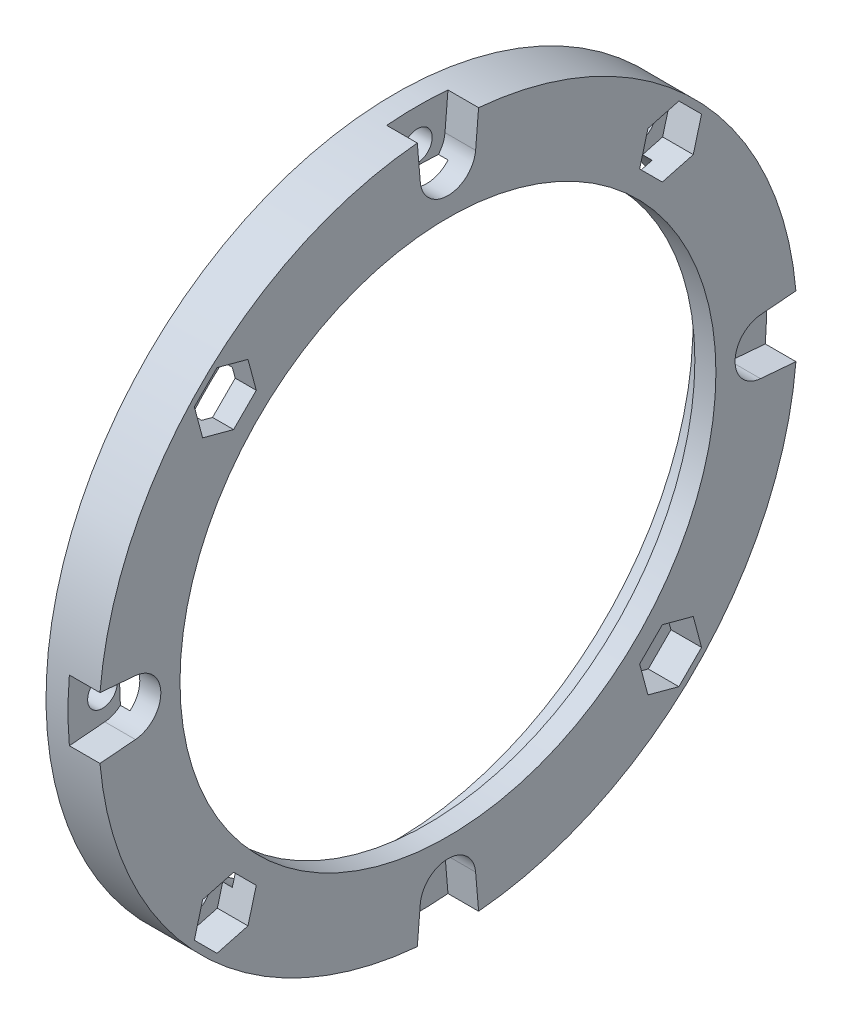
from build123d import *

# Parameters (mm, degrees)
SKETCH_1_R          = 36.5
SKETCH_1_R_2        = 28
EXTRUDE_1_DEPTH     = 5.5
SKETCH_2_R          = 31.1
CUT_EXTRUDE_1_DEPTH = 3.3
CUT_EXTRUDE_2_REACH = 53.911
SKETCH_3_R          = 1.55
SKETCH_4_R          = 1.55
CUT_EXTRUDE_3_DEPTH = 3.2


with BuildPart() as part:
    # 草图1 → 凸台-拉伸1 (new body)
    with BuildSketch(Plane(origin=(0, 0, 0), x_dir=(0, 0, -1), z_dir=(1, 0, 0))):
        Circle(SKETCH_1_R)
        Circle(SKETCH_1_R_2, mode=Mode.SUBTRACT)
    extrude(amount=EXTRUDE_1_DEPTH)

    # 草图2 → 切除-拉伸1 (cut)
    with BuildSketch(Plane.ZY):
        Circle(SKETCH_2_R)
    extrude(amount=-CUT_EXTRUDE_1_DEPTH, mode=Mode.SUBTRACT)

    # 草图3 → 切除-拉伸2 (cut, up to next)
    with BuildSketch(Plane(origin=(5.5, 0, 0), x_dir=(0, 0, -1), z_dir=(1, 0, 0)), mode=Mode.PRIVATE) as cut_extrude_2_sk1:
        with Locations((32.9, 0)):
            Circle(SKETCH_3_R)
    cut_extrude_2_tool1 = extrude(cut_extrude_2_sk1.sketch, amount=-CUT_EXTRUDE_2_REACH, mode=Mode.PRIVATE) & part.part
    # 草图3 → 切除-拉伸2 (cut, up to next)
    with BuildSketch(Plane(origin=(5.5, 0, 0), x_dir=(0, 0, -1), z_dir=(1, 0, 0)), mode=Mode.PRIVATE) as cut_extrude_2_sk2:
        with Locations((23.263813101, -23.263813101)):
            Circle(SKETCH_3_R)
    cut_extrude_2_tool2 = extrude(cut_extrude_2_sk2.sketch, amount=-CUT_EXTRUDE_2_REACH, mode=Mode.PRIVATE) & part.part
    # 草图3 → 切除-拉伸2 (cut, up to next)
    with BuildSketch(Plane(origin=(5.5, 0, 0), x_dir=(0, 0, -1), z_dir=(1, 0, 0)), mode=Mode.PRIVATE) as cut_extrude_2_sk3:
        with Locations((0, -32.9)):
            Circle(SKETCH_3_R)
    cut_extrude_2_tool3 = extrude(cut_extrude_2_sk3.sketch, amount=-CUT_EXTRUDE_2_REACH, mode=Mode.PRIVATE) & part.part
    # 草图3 → 切除-拉伸2 (cut, up to next)
    with BuildSketch(Plane(origin=(5.5, 0, 0), x_dir=(0, 0, -1), z_dir=(1, 0, 0)), mode=Mode.PRIVATE) as cut_extrude_2_sk4:
        with Locations((-23.263813101, -23.263813101)):
            Circle(SKETCH_3_R)
    cut_extrude_2_tool4 = extrude(cut_extrude_2_sk4.sketch, amount=-CUT_EXTRUDE_2_REACH, mode=Mode.PRIVATE) & part.part
    # 草图3 → 切除-拉伸2 (cut, up to next)
    with BuildSketch(Plane(origin=(5.5, 0, 0), x_dir=(0, 0, -1), z_dir=(1, 0, 0)), mode=Mode.PRIVATE) as cut_extrude_2_sk5:
        with Locations((-32.9, 0)):
            Circle(SKETCH_3_R)
    cut_extrude_2_tool5 = extrude(cut_extrude_2_sk5.sketch, amount=-CUT_EXTRUDE_2_REACH, mode=Mode.PRIVATE) & part.part
    # 草图3 → 切除-拉伸2 (cut, up to next)
    with BuildSketch(Plane(origin=(5.5, 0, 0), x_dir=(0, 0, -1), z_dir=(1, 0, 0)), mode=Mode.PRIVATE) as cut_extrude_2_sk6:
        with Locations((-23.263813101, 23.263813101)):
            Circle(SKETCH_3_R)
    cut_extrude_2_tool6 = extrude(cut_extrude_2_sk6.sketch, amount=-CUT_EXTRUDE_2_REACH, mode=Mode.PRIVATE) & part.part
    # 草图3 → 切除-拉伸2 (cut, up to next)
    with BuildSketch(Plane(origin=(5.5, 0, 0), x_dir=(0, 0, -1), z_dir=(1, 0, 0)), mode=Mode.PRIVATE) as cut_extrude_2_sk7:
        with Locations((0, 32.9)):
            Circle(SKETCH_3_R)
    cut_extrude_2_tool7 = extrude(cut_extrude_2_sk7.sketch, amount=-CUT_EXTRUDE_2_REACH, mode=Mode.PRIVATE) & part.part
    # 草图3 → 切除-拉伸2 (cut, up to next)
    with BuildSketch(Plane(origin=(5.5, 0, 0), x_dir=(0, 0, -1), z_dir=(1, 0, 0)), mode=Mode.PRIVATE) as cut_extrude_2_sk8:
        with Locations((23.263813101, 23.263813101)):
            Circle(SKETCH_3_R)
    cut_extrude_2_tool8 = extrude(cut_extrude_2_sk8.sketch, amount=-CUT_EXTRUDE_2_REACH, mode=Mode.PRIVATE) & part.part
    add(cut_extrude_2_tool1.solids().sort_by_distance((5.5, 0, -32.9))[0], mode=Mode.SUBTRACT)
    add(cut_extrude_2_tool2.solids().sort_by_distance((5.5, -23.263813, -23.263813))[0], mode=Mode.SUBTRACT)
    add(cut_extrude_2_tool3.solids().sort_by_distance((5.5, -32.9, 0))[0], mode=Mode.SUBTRACT)
    add(cut_extrude_2_tool4.solids().sort_by_distance((5.5, -23.263813, 23.263813))[0], mode=Mode.SUBTRACT)
    add(cut_extrude_2_tool5.solids().sort_by_distance((5.5, 0, 32.9))[0], mode=Mode.SUBTRACT)
    add(cut_extrude_2_tool6.solids().sort_by_distance((5.5, 23.263813, 23.263813))[0], mode=Mode.SUBTRACT)
    add(cut_extrude_2_tool7.solids().sort_by_distance((5.5, 32.9, 0))[0], mode=Mode.SUBTRACT)
    add(cut_extrude_2_tool8.solids().sort_by_distance((5.5, 23.263813, -23.263813))[0], mode=Mode.SUBTRACT)

    # 草图4 → 切除-拉伸3 (cut)
    # profile 1 of 8: a face of its own
    with BuildSketch(Plane(origin=(5.5, 0, 0), x_dir=(0, 0, -1), z_dir=(1, 0, 0))):
        with BuildLine():
            Line((-32.656757596, 2.889780811), (-36.359328813, 3.20143847))
            ThreePointArc((-36.359328813, 3.20143847), (-36.5, 0), (-36.359328813, -3.20143847))
            Line((-36.359328813, -3.20143847), (-32.656757596, -2.889780811))
            ThreePointArc((-32.656757596, -2.889780811), (-30, 0), (-32.656757596, 2.889780811))
        make_face()
        with Locations((-32.9, 0)):
            Circle(SKETCH_4_R, mode=Mode.SUBTRACT)
    # profile 2 of 8: a face of its own
    with BuildSketch(Plane(origin=(5.5, 0, 0), x_dir=(0, 0, -1), z_dir=(1, 0, 0))):
        with BuildLine():
            Line((2.889780811, 32.656757596), (3.20143847, 36.359328813))
            ThreePointArc((3.20143847, 36.359328813), (0, 36.5), (-3.20143847, 36.359328813))
            Line((-3.20143847, 36.359328813), (-2.889780811, 32.656757596))
            ThreePointArc((-2.889780811, 32.656757596), (0, 30), (2.889780811, 32.656757596))
        make_face()
        with Locations((0, 32.9)):
            Circle(SKETCH_4_R, mode=Mode.SUBTRACT)
    # profile 3 of 8: a face of its own
    with BuildSketch(Plane(origin=(5.5, 0, 0), x_dir=(0, 0, -1), z_dir=(1, 0, 0))):
        Polygon((26.498342809, 24.130502724), (24.130502724, 26.498342809), (20.895973016, 25.631653186), (20.029283393, 22.397123478), (22.397123478, 20.029283393), (25.631653186, 20.895973016), align=None)
        with Locations((23.263813101, 23.263813101)):
            Circle(SKETCH_4_R, mode=Mode.SUBTRACT)
    # profile 4 of 8: a face of its own
    with BuildSketch(Plane(origin=(5.5, 0, 0), x_dir=(0, 0, -1), z_dir=(1, 0, 0))):
        with BuildLine():
            Line((36.359328813, 3.20143847), (32.656757596, 2.889780811))
            ThreePointArc((32.656757596, 2.889780811), (30, 0), (32.656757596, -2.889780811))
            Line((32.656757596, -2.889780811), (36.359328813, -3.20143847))
            ThreePointArc((36.359328813, -3.20143847), (36.464815245, -1.602263763), (36.5, 0))
            ThreePointArc((36.5, 0), (36.464815245, 1.602263763), (36.359328813, 3.20143847))
        make_face()
        with Locations((32.9, 0)):
            Circle(SKETCH_4_R, mode=Mode.SUBTRACT)
    # profile 5 of 8: a face of its own
    with BuildSketch(Plane(origin=(5.5, 0, 0), x_dir=(0, 0, -1), z_dir=(1, 0, 0))):
        Polygon((24.130502724, -26.498342809), (26.498342809, -24.130502724), (25.631653186, -20.895973016), (22.397123478, -20.029283393), (20.029283393, -22.397123478), (20.895973016, -25.631653186), align=None)
        with Locations((23.263813101, -23.263813101)):
            Circle(SKETCH_4_R, mode=Mode.SUBTRACT)
    # profile 6 of 8: a face of its own
    with BuildSketch(Plane(origin=(5.5, 0, 0), x_dir=(0, 0, -1), z_dir=(1, 0, 0))):
        with BuildLine():
            ThreePointArc((-3.20143847, -36.359328813), (0, -36.5), (3.20143847, -36.359328813))
            Line((3.20143847, -36.359328813), (2.889780811, -32.656757596))
            ThreePointArc((2.889780811, -32.656757596), (0, -30), (-2.889780811, -32.656757596))
            Line((-2.889780811, -32.656757596), (-3.20143847, -36.359328813))
        make_face()
        with Locations((0, -32.9)):
            Circle(SKETCH_4_R, mode=Mode.SUBTRACT)
    # profile 7 of 8: a face of its own
    with BuildSketch(Plane(origin=(5.5, 0, 0), x_dir=(0, 0, -1), z_dir=(1, 0, 0))):
        Polygon((-20.895973016, -25.631653186), (-20.029283393, -22.397123478), (-22.397123478, -20.029283393), (-25.631653186, -20.895973016), (-26.498342809, -24.130502724), (-24.130502724, -26.498342809), align=None)
    # profile 8 of 8: a face of its own
    with BuildSketch(Plane(origin=(5.5, 0, 0), x_dir=(0, 0, -1), z_dir=(1, 0, 0))):
        Polygon((-20.029283393, 22.397123478), (-20.895973016, 25.631653186), (-24.130502724, 26.498342809), (-26.498342809, 24.130502724), (-25.631653186, 20.895973016), (-22.397123478, 20.029283393), align=None)
    extrude(amount=-CUT_EXTRUDE_3_DEPTH, mode=Mode.SUBTRACT)


solid = part.part
